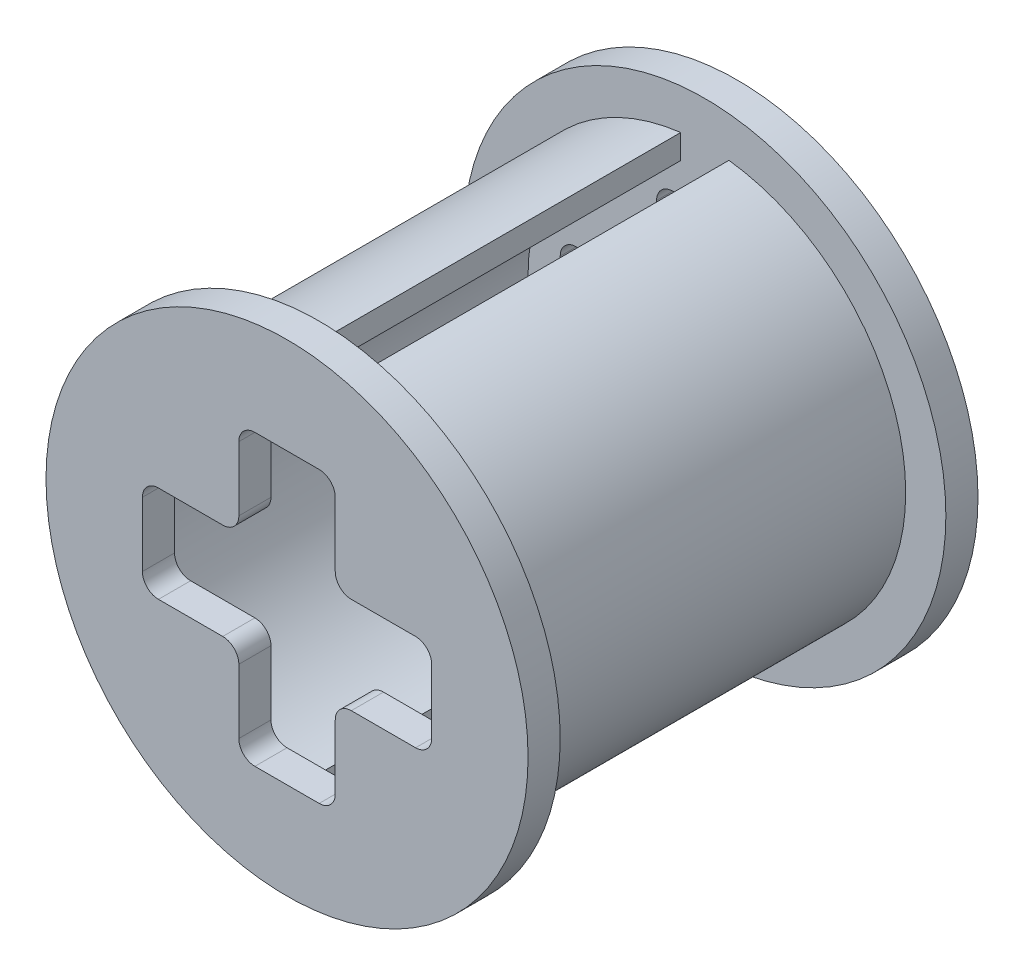
from build123d import *

# Parameters (mm, degrees)
EXTRUDE1_DEPTH     = 3.81
EXTRUDE2_DEPTH     = 0.508
CUT_EXTRUDE2_DEPTH = 15.094711526
EXTRUDE3_DEPTH     = 3.048
EXTRUDE4_REACH     = 14.678
SKETCH9_W          = 3.045663376
SKETCH9_H          = 0.1905
SKETCH11_R         = 2.286
CUT_EXTRUDE3_DEPTH = 13.677755519
SKETCH12_R         = 3.175
CUT_EXTRUDE4_DEPTH = 0.508
SKETCH13_OUTSIDE_W = 29.435
SKETCH13_OUTSIDE_H = 14.576
SKETCH13_OUTSIDE_R = 3.81
CUT_EXTRUDE5_DEPTH = 15.094711526
CUT_EXTRUDE7_START = 6.096
CUT_EXTRUDE7_DEPTH = 6.096


with BuildPart() as part:
    # Sketch1 → Extrude1 (new body)
    with BuildSketch(Plane(origin=(0, 0, 0), x_dir=(1, 0, 0), z_dir=(0, 1, 0))):
        with BuildLine():
            Line((-8.001, 3.556), (0, 3.556))
            ThreePointArc((0, 3.556), (3.556, 0), (0, -3.556))
            Line((0, -3.556), (-8.001, -3.556))
            ThreePointArc((-8.001, -3.556), (-11.557, 0), (-8.001, 3.556))
        make_face()
    extrude(amount=EXTRUDE1_DEPTH)

    # Sketch4 → Extrude2 (add)
    with BuildSketch(Plane.XY.offset(3.556)):
        with BuildLine():
            Line((0, 0), (0, 3.81))
            Line((0, 3.81), (7.112, 3.81))
            ThreePointArc((7.112, 3.81), (9.806076836, 2.694076836), (10.922, 0))
            Line((10.922, 0), (7.112, 0))
            Line((7.112, 0), (0, 0))
        make_face()
    extrude2 = extrude(amount=-EXTRUDE2_DEPTH)

    # Sketch6 → Cut-Extrude2 (cut, through all)
    with BuildSketch(Plane.XY.offset(3.556)):
        with BuildLine():
            Line((6.35, 2.032), (6.35, 1.016))
            ThreePointArc((6.35, 1.016), (6.275605122, 0.836394878), (6.096, 0.762))
            Line((6.096, 0.762), (5.08, 0.762))
            ThreePointArc((5.08, 0.762), (4.900394878, 0.687605122), (4.826, 0.508))
            Line((4.826, 0.508), (4.826, -0.508))
            ThreePointArc((4.826, -0.508), (4.900394878, -0.687605122), (5.08, -0.762))
            Line((5.08, -0.762), (6.096, -0.762))
            ThreePointArc((6.096, -0.762), (6.275605122, -0.836394878), (6.35, -1.016))
            Line((6.35, -1.016), (6.35, -2.032))
            ThreePointArc((6.35, -2.032), (6.424394878, -2.211605122), (6.604, -2.286))
            Line((6.604, -2.286), (7.62, -2.286))
            ThreePointArc((7.62, -2.286), (7.799605122, -2.211605122), (7.874, -2.032))
            Line((7.874, -2.032), (7.874, -1.016))
            ThreePointArc((7.874, -1.016), (7.948394878, -0.836394878), (8.128, -0.762))
            Line((8.128, -0.762), (9.144, -0.762))
            ThreePointArc((9.144, -0.762), (9.323605122, -0.687605122), (9.398, -0.508))
            Line((9.398, -0.508), (9.398, 0.508))
            ThreePointArc((9.398, 0.508), (9.323605122, 0.687605122), (9.144, 0.762))
            Line((9.144, 0.762), (8.128, 0.762))
            ThreePointArc((8.128, 0.762), (7.948394878, 0.836394878), (7.874, 1.016))
            Line((7.874, 1.016), (7.874, 2.032))
            ThreePointArc((7.874, 2.032), (7.799605122, 2.211605122), (7.62, 2.286))
            Line((7.62, 2.286), (6.604, 2.286))
            ThreePointArc((6.604, 2.286), (6.424394878, 2.211605122), (6.35, 2.032))
        make_face()
    cut_extrude2 = extrude(amount=-CUT_EXTRUDE2_DEPTH, mode=Mode.SUBTRACT)

    # Sketch8 → Extrude3 (add)
    with BuildSketch(Plane(origin=(0, 0, 3.048), x_dir=(-1, 0, 0), z_dir=(0, 0, -1))):
        with BuildLine():
            Line((-10.287, 0), (-9.906, 0))
            ThreePointArc((-9.906, 0), (-9.218056742, 1.836017701), (-7.493, 2.767900829))
            Line((-7.493, 2.767900829), (-7.493, 3.152057106))
            ThreePointArc((-7.493, 3.152057106), (-9.487952441, 2.106056742), (-10.287, 0))
        make_face()
        with BuildLine():
            Line((-4.318, 0), (-3.937, 0))
            ThreePointArc((-3.937, 0), (-4.736047559, 2.106056742), (-6.731, 3.152057106))
            Line((-6.731, 3.152057106), (-6.731, 2.767900829))
            ThreePointArc((-6.731, 2.767900829), (-5.005943258, 1.836017701), (-4.318, 0))
        make_face()
    extrude3 = extrude(amount=EXTRUDE3_DEPTH)

    # Sketch9 → Extrude4 (add, up to next)
    with BuildSketch(Plane(origin=(0, 0, 0), x_dir=(-1, 0, 0), z_dir=(0, 0, -1)), mode=Mode.PRIVATE) as extrude4_sk1:
        with Locations((-2.604668312, 0.09525)):
            Rectangle(SKETCH9_W, SKETCH9_H)
    extrude4_tool1 = extrude(extrude4_sk1.sketch, amount=-EXTRUDE4_REACH, mode=Mode.PRIVATE) - part.part
    extrude4 = extrude4_tool1.solids().sort_by_distance((2.604668, 0.09525, 0))[0]
    add(extrude4)

    # Mirror5: Extrude2, Cut-Extrude2, Extrude3, Extrude4 across plane
    add(extrude2.mirror(Plane(origin=(7.112, 0, 0), x_dir=(1, 0, 0), z_dir=(0, 0, -1))))
    add(cut_extrude2.mirror(Plane(origin=(7.112, 0, 0), x_dir=(1, 0, 0), z_dir=(0, 0, -1))), mode=Mode.SUBTRACT)
    add(extrude3.mirror(Plane(origin=(7.112, 0, 0), x_dir=(1, 0, 0), z_dir=(0, 0, -1))))
    add(extrude4.mirror(Plane(origin=(7.112, 0, 0), x_dir=(1, 0, 0), z_dir=(0, 0, -1))))

    # Sketch11 → Cut-Extrude3 (cut, through all)
    with BuildSketch(Plane(origin=(0, 3.81, 0), x_dir=(1, 0, 0), z_dir=(0, 1, 0))):
        with Locations(Location((0, 0, 0), (0, 0, 270))):
            Circle(SKETCH11_R)
        with Locations(Location((-8.001, 0, 0), (0, 0, 270))):
            Circle(SKETCH11_R)
    extrude(amount=-CUT_EXTRUDE3_DEPTH, mode=Mode.SUBTRACT)

    # Sketch12 → Cut-Extrude4 (cut)
    with BuildSketch(Plane(origin=(0, 3.81, 0), x_dir=(1, 0, 0), z_dir=(0, 1, 0))):
        with Locations(Location((0, 0, 0), (0, 0, 270))):
            Circle(SKETCH12_R)
        with Locations(Location((-8.001, 0, 0), (0, 0, 270))):
            Circle(SKETCH12_R)
    extrude(amount=-CUT_EXTRUDE4_DEPTH, mode=Mode.SUBTRACT)

    # Mirror6: part across face


with BuildPart() as part_1:
    add(part.part)
    add(part.part.mirror(Plane(origin=(-2.880961452, 0, 0), x_dir=(0, 0, 1), z_dir=(0, -1, 0))))

    # Sketch13 outside → Cut-Extrude5 (cut, through all)
    with BuildSketch(Plane.XY.offset(3.556)):
        with Locations((-0.3175, 0)):
            Rectangle(SKETCH13_OUTSIDE_W, SKETCH13_OUTSIDE_H)
        with Locations((7.112, 0)):
            Circle(SKETCH13_OUTSIDE_R, mode=Mode.SUBTRACT)
    extrude(amount=-CUT_EXTRUDE5_DEPTH, mode=Mode.SUBTRACT)

    # Sketch15 → Cut-Extrude7 (cut)
    with BuildSketch(Plane.XY.offset(-3.048).offset(CUT_EXTRUDE7_START)):
        with BuildLine():
            Line((4.158713877, 2.407114678), (5.041631935, 2.407114678))
            ThreePointArc((5.041631935, 2.407114678), (3.937, 0), (5.041631935, -2.407114678))
            Line((5.041631935, -2.407114678), (4.158713877, -2.407114678))
            ThreePointArc((4.158713877, -2.407114678), (3.302, 0), (4.158713877, 2.407114678))
        make_face()
    extrude(amount=-CUT_EXTRUDE7_DEPTH, mode=Mode.SUBTRACT)


solid = part_1.part
